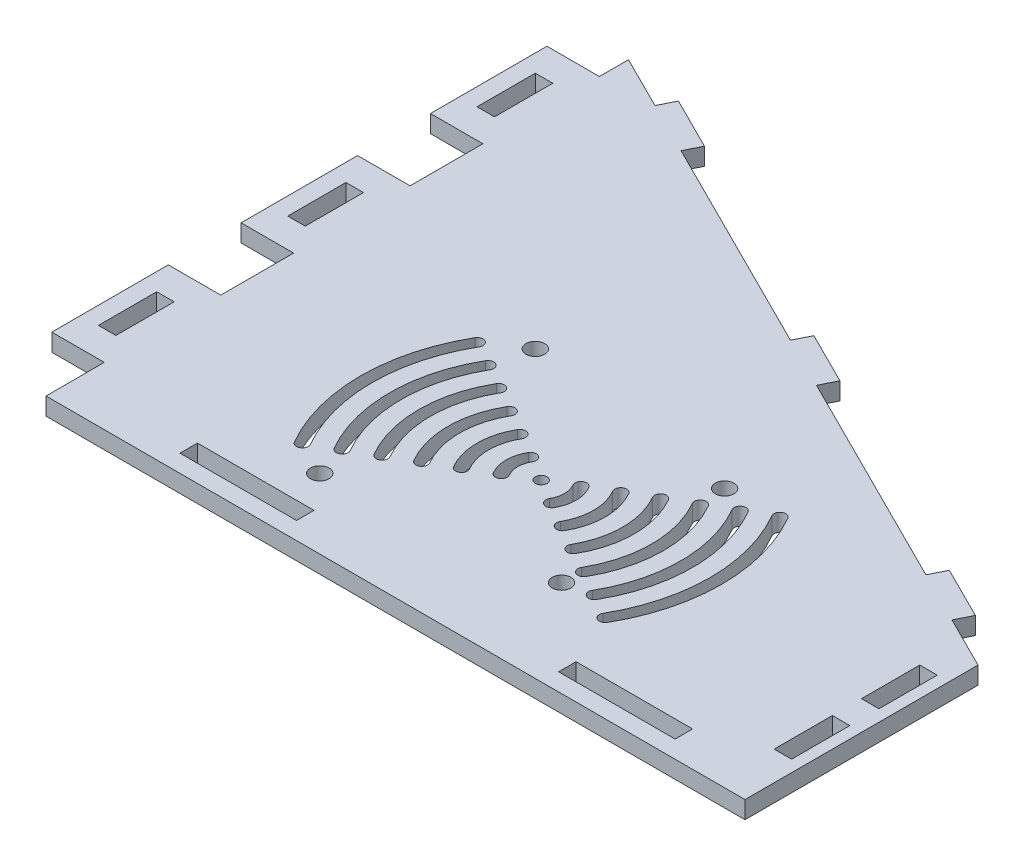
from build123d import *

# Parameters (mm, degrees)
SKETCH1_W           = 3
SKETCH1_H           = 10
SKETCH1_W_2         = 20
SKETCH1_H_2         = 3
BOSS_EXTRUDE1_DEPTH = 3
SKETCH2_R           = 1
SKETCH2_R_2         = 1.6
CUT_EXTRUDE1_DEPTH  = 3


with BuildPart() as part:
    # Sketch1 → Boss-Extrude1 (new body)
    with BuildSketch(Plane(origin=(0, 0, 0), x_dir=(1, 0, 0), z_dir=(0, 1, 0))):
        Polygon((0, 0), (0, 10), (-9, 10), (-9, 30), (0, 30), (0, 42.5), (-9, 42.5), (-9, 62.5), (0, 62.5), (0, 75), (-9, 75), (-9, 95), (0, 95), (0, 100), (9.091028316, 95.454485842), (10.432669103, 98.137767415), (19.376941013, 93.66563146), (18.035300226, 90.982349887), (55.601242248, 72.199378876), (56.942883035, 74.882660449), (65.887154945, 70.410524494), (64.545514158, 67.727242921), (102.11145618, 48.94427191), (103.453096967, 51.627553483), (112.397368877, 47.155417528), (111.05572809, 44.472135955), (120, 40), (120, 0), align=None)
        with Locations((116.5, 30)):
            Rectangle(SKETCH1_W, SKETCH1_H, mode=Mode.SUBTRACT)
        with Locations((116.5, 15)):
            Rectangle(SKETCH1_W, SKETCH1_H, mode=Mode.SUBTRACT)
        with Locations((30, 4.5)):
            Rectangle(SKETCH1_W_2, SKETCH1_H_2, mode=Mode.SUBTRACT)
        with Locations((95, 4.5)):
            Rectangle(SKETCH1_W_2, SKETCH1_H_2, mode=Mode.SUBTRACT)
        with Locations((-4.5, 85)):
            Rectangle(SKETCH1_W, SKETCH1_H, mode=Mode.SUBTRACT)
        with Locations((-4.5, 52.5)):
            Rectangle(SKETCH1_W, SKETCH1_H, mode=Mode.SUBTRACT)
        with Locations((-4.5, 20)):
            Rectangle(SKETCH1_W, SKETCH1_H, mode=Mode.SUBTRACT)
    extrude(amount=BOSS_EXTRUDE1_DEPTH)

    # Sketch2 → Cut-Extrude1 (cut)
    with BuildSketch(Plane.XZ):
        with Locations(Location((55, -30, 0), (0, 0, 270))):
            Circle(SKETCH2_R)
        with Locations(Location((35, -49, 0), (0, 0, 270))):
            Circle(SKETCH2_R_2)
        with Locations(Location((72, -44.5, 0), (0, 0, 270))):
            Circle(SKETCH2_R_2)
        with Locations(Location((72, -16.5, 0), (0, 0, 270))):
            Circle(SKETCH2_R_2)
        with Locations(Location((35, -12, 0), (0, 0, 270))):
            Circle(SKETCH2_R_2)
        with BuildLine():
            ThreePointArc((49.803847577, -27), (49, -30), (49.803847577, -33))
            ThreePointArc((49.803847577, -33), (51.169872981, -33.366025404), (51.535898385, -32))
            ThreePointArc((51.535898385, -32), (51, -30), (51.535898385, -28))
            ThreePointArc((51.535898385, -28), (51.169872981, -26.633974596), (49.803847577, -27))
        make_face()
        with BuildLine():
            ThreePointArc((45.473720558, -24.5), (44, -30), (45.473720558, -35.5))
            ThreePointArc((45.473720558, -35.5), (46.839745962, -35.866025404), (47.205771366, -34.5))
            ThreePointArc((47.205771366, -34.5), (46, -30), (47.205771366, -25.5))
            ThreePointArc((47.205771366, -25.5), (46.839745962, -24.133974596), (45.473720558, -24.5))
        make_face()
        with BuildLine():
            ThreePointArc((41.143593539, -22), (39, -30), (41.143593539, -38))
            ThreePointArc((41.143593539, -38), (42.509618943, -38.366025404), (42.875644347, -37))
            ThreePointArc((42.875644347, -37), (41, -30), (42.875644347, -23))
            ThreePointArc((42.875644347, -23), (42.509618943, -21.633974596), (41.143593539, -22))
        make_face()
        with BuildLine():
            ThreePointArc((36.813466521, -19.5), (34, -30), (36.813466521, -40.5))
            ThreePointArc((36.813466521, -40.5), (38.179491924, -40.866025404), (38.545517328, -39.5))
            ThreePointArc((38.545517328, -39.5), (36, -30), (38.545517328, -20.5))
            ThreePointArc((38.545517328, -20.5), (38.179491924, -19.133974596), (36.813466521, -19.5))
        make_face()
        with BuildLine():
            ThreePointArc((32.483339502, -17), (29, -30), (32.483339502, -43))
            ThreePointArc((32.483339502, -43), (33.849364905, -43.366025404), (34.215390309, -42))
            ThreePointArc((34.215390309, -42), (31, -30), (34.215390309, -18))
            ThreePointArc((34.215390309, -18), (33.849364905, -16.633974596), (32.483339502, -17))
        make_face()
        with BuildLine():
            ThreePointArc((28.153212483, -14.5), (24, -30), (28.153212483, -45.5))
            ThreePointArc((28.153212483, -45.5), (29.519237886, -45.866025404), (29.88526329, -44.5))
            ThreePointArc((29.88526329, -44.5), (26, -30), (29.88526329, -15.5))
            ThreePointArc((29.88526329, -15.5), (29.519237886, -14.133974596), (28.153212483, -14.5))
        make_face()
        with BuildLine():
            ThreePointArc((81.846787517, -14.5), (86, -30), (81.846787517, -45.5))
            ThreePointArc((81.846787517, -45.5), (80.480762114, -45.866025404), (80.11473671, -44.5))
            ThreePointArc((80.11473671, -44.5), (84, -30), (80.11473671, -15.5))
            ThreePointArc((80.11473671, -15.5), (80.480762114, -14.133974596), (81.846787517, -14.5))
        make_face()
        with BuildLine():
            ThreePointArc((77.516660498, -17), (81, -30), (77.516660498, -43))
            ThreePointArc((77.516660498, -43), (76.150635095, -43.366025404), (75.784609691, -42))
            ThreePointArc((75.784609691, -42), (79, -30), (75.784609691, -18))
            ThreePointArc((75.784609691, -18), (76.150635095, -16.633974596), (77.516660498, -17))
        make_face()
        with BuildLine():
            ThreePointArc((73.186533479, -19.5), (76, -30), (73.186533479, -40.5))
            ThreePointArc((73.186533479, -40.5), (71.820508076, -40.866025404), (71.454482672, -39.5))
            ThreePointArc((71.454482672, -39.5), (74, -30), (71.454482672, -20.5))
            ThreePointArc((71.454482672, -20.5), (71.820508076, -19.133974596), (73.186533479, -19.5))
        make_face()
        with BuildLine():
            ThreePointArc((68.856406461, -22), (71, -30), (68.856406461, -38))
            ThreePointArc((68.856406461, -38), (67.490381057, -38.366025404), (67.124355653, -37))
            ThreePointArc((67.124355653, -37), (69, -30), (67.124355653, -23))
            ThreePointArc((67.124355653, -23), (67.490381057, -21.633974596), (68.856406461, -22))
        make_face()
        with BuildLine():
            ThreePointArc((64.526279442, -24.5), (66, -30), (64.526279442, -35.5))
            ThreePointArc((64.526279442, -35.5), (63.160254038, -35.866025404), (62.794228634, -34.5))
            ThreePointArc((62.794228634, -34.5), (64, -30), (62.794228634, -25.5))
            ThreePointArc((62.794228634, -25.5), (63.160254038, -24.133974596), (64.526279442, -24.5))
        make_face()
        with BuildLine():
            ThreePointArc((60.196152423, -27), (61, -30), (60.196152423, -33))
            ThreePointArc((60.196152423, -33), (58.830127019, -33.366025404), (58.464101615, -32))
            ThreePointArc((58.464101615, -32), (59, -30), (58.464101615, -28))
            ThreePointArc((58.464101615, -28), (58.830127019, -26.633974596), (60.196152423, -27))
        make_face()
    extrude(amount=-CUT_EXTRUDE1_DEPTH, mode=Mode.SUBTRACT)


solid = part.part
